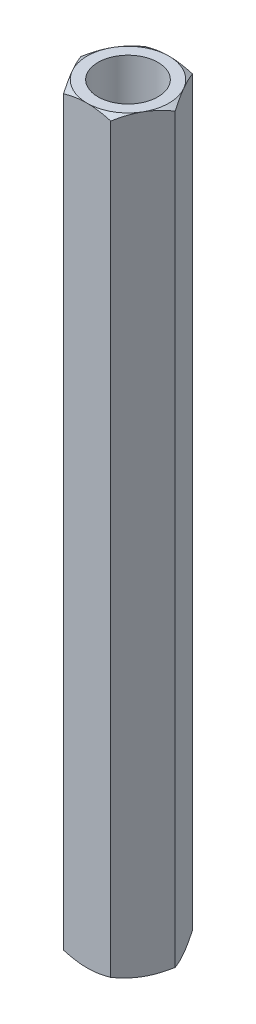
from build123d import *

# Parameters (mm, degrees)
SKETCH_1_R          = 2
EXTRUDE_1_DEPTH     = 50
SKETCH_2_OUTSIDE_W  = 195.708
SKETCH_2_OUTSIDE_H  = 194.864
SKETCH_2_OUTSIDE_R  = 2.727980022
CUT_EXTRUDE_1_DEPTH = 51.173343271
CUT_EXTRUDE_1_DRAFT = -60
SKETCH_3_OUTSIDE_W  = 195.708
SKETCH_3_OUTSIDE_H  = 194.864
SKETCH_3_OUTSIDE_R  = 2.727980022
CUT_EXTRUDE_2_DEPTH = 51.173343271
CUT_EXTRUDE_2_DRAFT = -60


with BuildPart() as part:
    # 草图1 → 凸台-拉伸1 (new body)
    with BuildSketch(Plane(origin=(0, 0, 0), x_dir=(1, 0, 0), z_dir=(0, 1, 0))):
        Polygon((1.575, 2.727980022), (-1.575, 2.727980022), (-3.15, 0), (-1.575, -2.727980022), (1.575, -2.727980022), (3.15, 0), align=None)
        Circle(SKETCH_1_R, mode=Mode.SUBTRACT)
    extrude(amount=EXTRUDE_1_DEPTH)


with BuildPart() as cut_extrude_1_tool:
    # 草图2 outside → 切除-拉伸1 (with draft: the straight prism first)
    with BuildSketch(Plane.XZ):
        Rectangle(SKETCH_2_OUTSIDE_W, SKETCH_2_OUTSIDE_H)
        Circle(SKETCH_2_OUTSIDE_R, mode=Mode.SUBTRACT)
    extrude(amount=-CUT_EXTRUDE_1_DEPTH)
    # 切除-拉伸1: the draft: its side faces are tilted about the plane it starts from
    cut_extrude_1_sides = [cut_extrude_1_tool.faces().sort_by_distance(p)[0] for p in [
        (0, 25.586671636, -97.432),
        (97.854, 25.586671636, 0),
        (0, 25.586671636, 97.432),
        (-97.854, 25.586671636, 0),
        (-2.727980022, 25.586671636, 0),
    ]]
    draft(cut_extrude_1_sides, Plane.XZ, CUT_EXTRUDE_1_DRAFT)


with BuildPart() as part_1:
    add(part.part)

    # 切除-拉伸1: cut by cut_extrude_1_tool
    add(cut_extrude_1_tool.part, mode=Mode.SUBTRACT)


with BuildPart() as cut_extrude_2_tool:
    # 草图3 outside → 切除-拉伸2 (with draft: the straight prism first)
    with BuildSketch(Plane(origin=(0, 50, 0), x_dir=(1, 0, 0), z_dir=(0, 1, 0))):
        Rectangle(SKETCH_3_OUTSIDE_W, SKETCH_3_OUTSIDE_H)
        Circle(SKETCH_3_OUTSIDE_R, mode=Mode.SUBTRACT)
    extrude(amount=-CUT_EXTRUDE_2_DEPTH)
    # 切除-拉伸2: the draft: its side faces are tilted about the plane it starts from
    cut_extrude_2_sides = [cut_extrude_2_tool.faces().sort_by_distance(p)[0] for p in [
        (0, 24.413328364, 97.432),
        (97.854, 24.413328364, 0),
        (0, 24.413328364, -97.432),
        (-97.854, 24.413328364, 0),
        (-2.727980022, 24.413328364, 0),
    ]]
    draft(cut_extrude_2_sides, Plane(origin=(0, 50, 0), x_dir=(1, 0, 0), z_dir=(0, 1, 0)), CUT_EXTRUDE_2_DRAFT)


with BuildPart() as part_2:
    add(part_1.part)

    # 切除-拉伸2: cut by cut_extrude_2_tool
    add(cut_extrude_2_tool.part, mode=Mode.SUBTRACT)


solid = part_2.part
